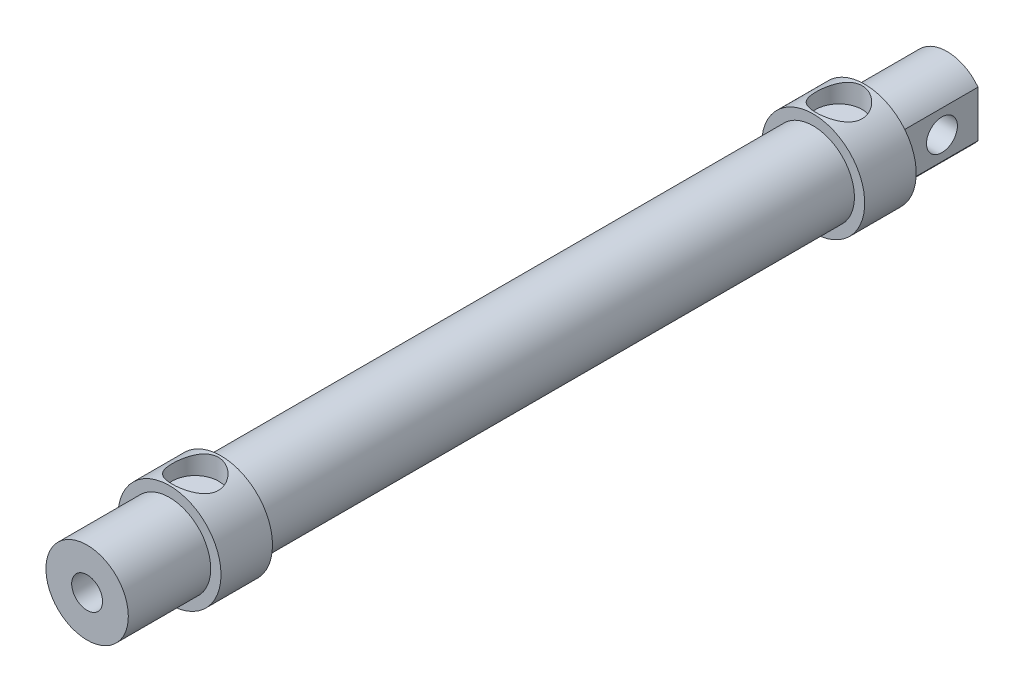
from build123d import *

# Parameters (mm, degrees)
SKETCH1_R           = 8
BOSS_EXTRUDE1_DEPTH = 115
SKETCH2_R           = 10
BOSS_EXTRUDE2_DEPTH = 10
BOSS_EXTRUDE3_START = 10
SKETCH3_R           = 10
BOSS_EXTRUDE3_DEPTH = 10
SKETCH4_R           = 8
BOSS_EXTRUDE4_DEPTH = 16
SKETCH5_R           = 7.5
BOSS_EXTRUDE5_DEPTH = 16
SKETCH6_R           = 3
CUT_EXTRUDE1_DEPTH  = 75
SKETCH7_R           = 4.5
CUT_EXTRUDE2_DEPTH  = 4
CUT_EXTRUDE3_START  = -16
CUT_EXTRUDE3_DEPTH  = 16
SKETCH9_R           = 3
CUT_EXTRUDE4_DEPTH  = 143.256810049


with BuildPart() as part:
    # Sketch1 → Boss-Extrude1 (new body)
    with BuildSketch(Plane.XY):
        Circle(SKETCH1_R)
    extrude(amount=BOSS_EXTRUDE1_DEPTH)

    # Sketch2 → Boss-Extrude2 (add)
    with BuildSketch(Plane(origin=(0, 0, 0), x_dir=(-1, 0, 0), z_dir=(0, 0, -1))):
        Circle(SKETCH2_R)
    extrude(amount=BOSS_EXTRUDE2_DEPTH)

    # Sketch3 → Boss-Extrude3 (add)
    with BuildSketch(Plane.XY.offset(115).offset(BOSS_EXTRUDE3_START)):
        with Locations(Location((0, 0, 0), (0, 0, 180))):
            Circle(SKETCH3_R)
    extrude(amount=-BOSS_EXTRUDE3_DEPTH)

    # Sketch4 → Boss-Extrude4 (add)
    with BuildSketch(Plane.XY.offset(125)):
        with Locations(Location((0, 0, 0), (0, 0, 180))):
            Circle(SKETCH4_R)
    extrude(amount=BOSS_EXTRUDE4_DEPTH)

    # Sketch5 → Boss-Extrude5 (add)
    with BuildSketch(Plane(origin=(0, 0, -10), x_dir=(-1, 0, 0), z_dir=(0, 0, -1))):
        Circle(SKETCH5_R)
    extrude(amount=BOSS_EXTRUDE5_DEPTH)

    # Sketch6 → Cut-Extrude1 (cut)
    with BuildSketch(Plane.XY.offset(141)):
        Circle(SKETCH6_R)
    extrude(amount=-CUT_EXTRUDE1_DEPTH, mode=Mode.SUBTRACT)

    # Sketch7 → Cut-Extrude2 (cut)
    with BuildSketch(Plane(origin=(0, 10, 0), x_dir=(-1, 0, 0), z_dir=(0, 1, 0))):
        with Locations(Location((0, 120, 0), (0, 0, 90))):
            Circle(SKETCH7_R)
        with Locations(Location((0, -5, 0), (0, 0, 90))):
            Circle(SKETCH7_R)
    extrude(amount=-CUT_EXTRUDE2_DEPTH, mode=Mode.SUBTRACT)

    # Sketch8 → Cut-Extrude3 (cut)
    with BuildSketch(Plane(origin=(0, 0, -26), x_dir=(-1, 0, 0), z_dir=(0, 0, -1)).offset(CUT_EXTRUDE3_START)):
        with BuildLine():
            Line((-6, 4.5), (-6, -4.5))
            ThreePointArc((-6, -4.5), (-7.5, 0), (-6, 4.5))
        make_face()
        with BuildLine():
            Line((6, 4.5), (6, -4.5))
            ThreePointArc((6, -4.5), (7.5, 0), (6, 4.5))
        make_face()
    extrude(amount=CUT_EXTRUDE3_DEPTH, mode=Mode.SUBTRACT)

    # Sketch9 → Cut-Extrude4 (cut, through all)
    with BuildSketch(Plane(origin=(6, 0, 0), x_dir=(0, 0, -1), z_dir=(1, 0, 0))):
        with Locations((19, 0)):
            Circle(SKETCH9_R)
    extrude(amount=-CUT_EXTRUDE4_DEPTH, mode=Mode.SUBTRACT)


solid = part.part
